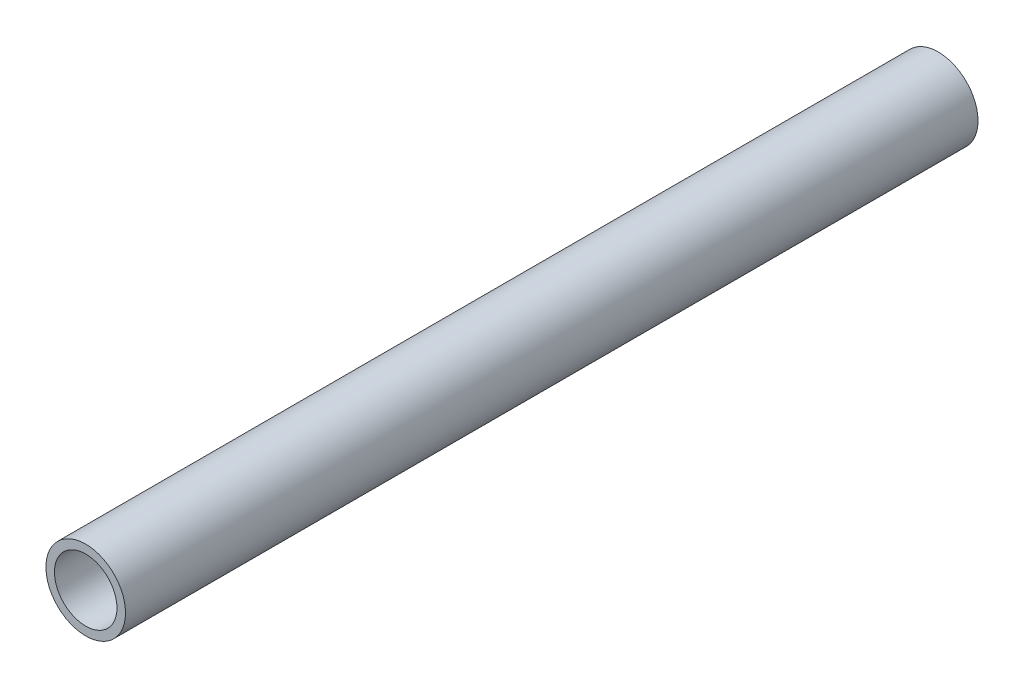
from build123d import *

# Parameters (mm, degrees)
SKETCH1_R           = 7
BOSS_EXTRUDE1_DEPTH = 150
SKETCH2_R           = 5.5
CUT_EXTRUDE1_DEPTH  = 151.326311736


with BuildPart() as part:
    # Sketch1 → Boss-Extrude1 (new body)
    with BuildSketch(Plane.XY):
        Circle(SKETCH1_R)
    extrude(amount=BOSS_EXTRUDE1_DEPTH)

    # Sketch2 → Cut-Extrude1 (cut, through all)
    with BuildSketch(Plane.XY.offset(150)):
        Circle(SKETCH2_R)
    extrude(amount=-CUT_EXTRUDE1_DEPTH, mode=Mode.SUBTRACT)


solid = part.part
